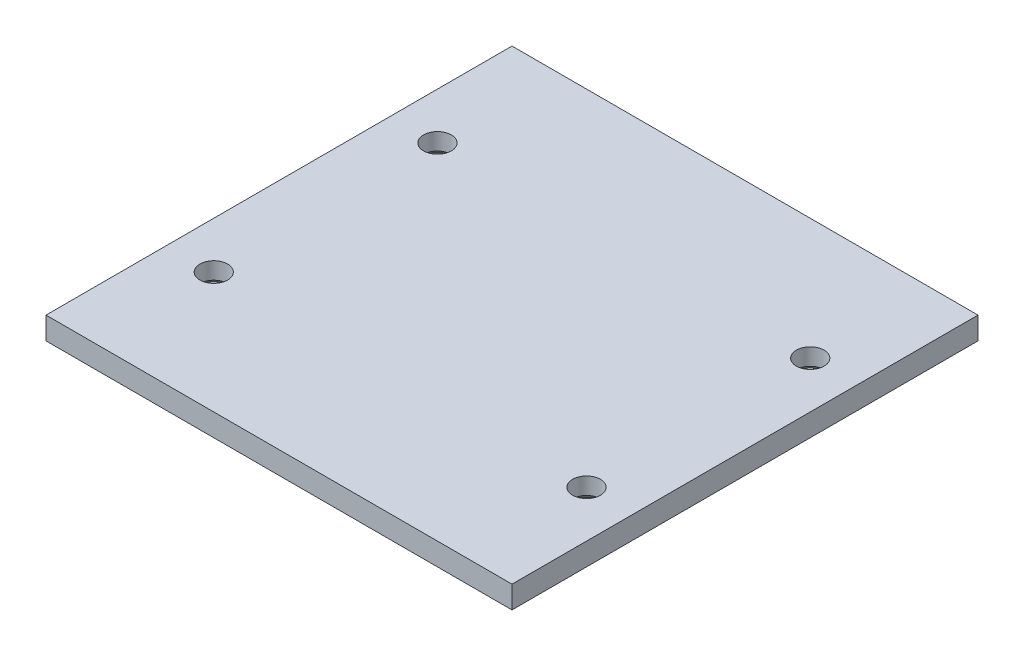
from build123d import *

# Parameters (mm, degrees)
SKETCH1_W                                       = 125
SKETCH1_H                                       = 125
SKETCH1_R                                       = 3.724428854
BOSS_EXTRUDE2_DEPTH                             = 6
SKETCH3_R                                       = 2
CUT_EXTRUDE1_DEPTH                              = 5
CSK_FOR_M5_FLAT_HEAD_MACHINE_SCREW1_D           = 5.8
CSK_FOR_M5_FLAT_HEAD_MACHINE_SCREW1_DEPTH       = 6
CSK_FOR_M5_FLAT_HEAD_MACHINE_SCREW1_CSINK_D     = 10.4
CSK_FOR_M5_FLAT_HEAD_MACHINE_SCREW1_CSINK_ANGLE = 90
CSK_FOR_M5_FLAT_HEAD_MACHINE_SCREW1_TIP         = 1.742495795
CSK_FOR_M5_FLAT_HEAD_MACHINE_SCREW3_D           = 5.8
CSK_FOR_M5_FLAT_HEAD_MACHINE_SCREW3_DEPTH       = 6
CSK_FOR_M5_FLAT_HEAD_MACHINE_SCREW3_CSINK_D     = 10.4
CSK_FOR_M5_FLAT_HEAD_MACHINE_SCREW3_CSINK_ANGLE = 90
CSK_FOR_M5_FLAT_HEAD_MACHINE_SCREW3_TIP         = 1.742495795
CSK_FOR_M5_FLAT_HEAD_MACHINE_SCREW4_D           = 5.8
CSK_FOR_M5_FLAT_HEAD_MACHINE_SCREW4_DEPTH       = 6
CSK_FOR_M5_FLAT_HEAD_MACHINE_SCREW4_CSINK_D     = 10.4
CSK_FOR_M5_FLAT_HEAD_MACHINE_SCREW4_CSINK_ANGLE = 90
CSK_FOR_M5_FLAT_HEAD_MACHINE_SCREW4_TIP         = 1.742495795
CSK_FOR_M5_FLAT_HEAD_MACHINE_SCREW5_D           = 5.8
CSK_FOR_M5_FLAT_HEAD_MACHINE_SCREW5_DEPTH       = 6
CSK_FOR_M5_FLAT_HEAD_MACHINE_SCREW5_CSINK_D     = 10.4
CSK_FOR_M5_FLAT_HEAD_MACHINE_SCREW5_CSINK_ANGLE = 90
CSK_FOR_M5_FLAT_HEAD_MACHINE_SCREW5_TIP         = 1.742495795


with BuildPart() as part:
    # Sketch1 → Boss-Extrude2 (new body)
    with BuildSketch(Plane(origin=(0, 0, 0), x_dir=(1, 0, 0), z_dir=(0, 1, 0))):
        Rectangle(SKETCH1_W, SKETCH1_H)
        with Locations(Location((50, 30, 0), (0, 0, 270))):
            Circle(SKETCH1_R, mode=Mode.SUBTRACT)
        with Locations(Location((-50, 30, 0), (0, 0, 270))):
            Circle(SKETCH1_R, mode=Mode.SUBTRACT)
        with Locations(Location((-50, -30, 0), (0, 0, 270))):
            Circle(SKETCH1_R, mode=Mode.SUBTRACT)
        with Locations(Location((50, -30, 0), (0, 0, 270))):
            Circle(SKETCH1_R, mode=Mode.SUBTRACT)
    extrude(amount=BOSS_EXTRUDE2_DEPTH)

    # Sketch3 → Cut-Extrude1 (cut)
    with BuildSketch(Plane(origin=(0, 0, -62.5), x_dir=(-1, 0, 0), z_dir=(0, 0, -1))):
        with Locations((0.738370199, 3)):
            Circle(SKETCH3_R)
    extrude(amount=-CUT_EXTRUDE1_DEPTH, mode=Mode.SUBTRACT)

    # CSK for M5 Flat Head Machine Screw1
    with Locations(Plane(origin=(50, 0, -30), x_dir=(0, 0, -1), z_dir=(0, -1, 0))):
        with Locations((0, 0)):
            CounterSinkHole(CSK_FOR_M5_FLAT_HEAD_MACHINE_SCREW1_D / 2, CSK_FOR_M5_FLAT_HEAD_MACHINE_SCREW1_CSINK_D / 2, depth=CSK_FOR_M5_FLAT_HEAD_MACHINE_SCREW1_DEPTH, counter_sink_angle=CSK_FOR_M5_FLAT_HEAD_MACHINE_SCREW1_CSINK_ANGLE)
            with Locations((0, 0, -(CSK_FOR_M5_FLAT_HEAD_MACHINE_SCREW1_DEPTH + CSK_FOR_M5_FLAT_HEAD_MACHINE_SCREW1_TIP / 2))):  # 118° drill point
                Cone(0, CSK_FOR_M5_FLAT_HEAD_MACHINE_SCREW1_D / 2, CSK_FOR_M5_FLAT_HEAD_MACHINE_SCREW1_TIP, mode=Mode.SUBTRACT)

    # CSK for M5 Flat Head Machine Screw3
    with Locations(Plane(origin=(-50, 0, -30), x_dir=(0, 0, -1), z_dir=(0, -1, 0))):
        with Locations((0, 0)):
            CounterSinkHole(CSK_FOR_M5_FLAT_HEAD_MACHINE_SCREW3_D / 2, CSK_FOR_M5_FLAT_HEAD_MACHINE_SCREW3_CSINK_D / 2, depth=CSK_FOR_M5_FLAT_HEAD_MACHINE_SCREW3_DEPTH, counter_sink_angle=CSK_FOR_M5_FLAT_HEAD_MACHINE_SCREW3_CSINK_ANGLE)
            with Locations((0, 0, -(CSK_FOR_M5_FLAT_HEAD_MACHINE_SCREW3_DEPTH + CSK_FOR_M5_FLAT_HEAD_MACHINE_SCREW3_TIP / 2))):  # 118° drill point
                Cone(0, CSK_FOR_M5_FLAT_HEAD_MACHINE_SCREW3_D / 2, CSK_FOR_M5_FLAT_HEAD_MACHINE_SCREW3_TIP, mode=Mode.SUBTRACT)

    # CSK for M5 Flat Head Machine Screw4
    with Locations(Plane(origin=(-50, 0, 30), x_dir=(0, 0, -1), z_dir=(0, -1, 0))):
        with Locations((0, 0)):
            CounterSinkHole(CSK_FOR_M5_FLAT_HEAD_MACHINE_SCREW4_D / 2, CSK_FOR_M5_FLAT_HEAD_MACHINE_SCREW4_CSINK_D / 2, depth=CSK_FOR_M5_FLAT_HEAD_MACHINE_SCREW4_DEPTH, counter_sink_angle=CSK_FOR_M5_FLAT_HEAD_MACHINE_SCREW4_CSINK_ANGLE)
            with Locations((0, 0, -(CSK_FOR_M5_FLAT_HEAD_MACHINE_SCREW4_DEPTH + CSK_FOR_M5_FLAT_HEAD_MACHINE_SCREW4_TIP / 2))):  # 118° drill point
                Cone(0, CSK_FOR_M5_FLAT_HEAD_MACHINE_SCREW4_D / 2, CSK_FOR_M5_FLAT_HEAD_MACHINE_SCREW4_TIP, mode=Mode.SUBTRACT)

    # CSK for M5 Flat Head Machine Screw5
    with Locations(Plane(origin=(50, 0, 30), x_dir=(0, 0, -1), z_dir=(0, -1, 0))):
        with Locations((0, 0)):
            CounterSinkHole(CSK_FOR_M5_FLAT_HEAD_MACHINE_SCREW5_D / 2, CSK_FOR_M5_FLAT_HEAD_MACHINE_SCREW5_CSINK_D / 2, depth=CSK_FOR_M5_FLAT_HEAD_MACHINE_SCREW5_DEPTH, counter_sink_angle=CSK_FOR_M5_FLAT_HEAD_MACHINE_SCREW5_CSINK_ANGLE)
            with Locations((0, 0, -(CSK_FOR_M5_FLAT_HEAD_MACHINE_SCREW5_DEPTH + CSK_FOR_M5_FLAT_HEAD_MACHINE_SCREW5_TIP / 2))):  # 118° drill point
                Cone(0, CSK_FOR_M5_FLAT_HEAD_MACHINE_SCREW5_D / 2, CSK_FOR_M5_FLAT_HEAD_MACHINE_SCREW5_TIP, mode=Mode.SUBTRACT)


solid = part.part
